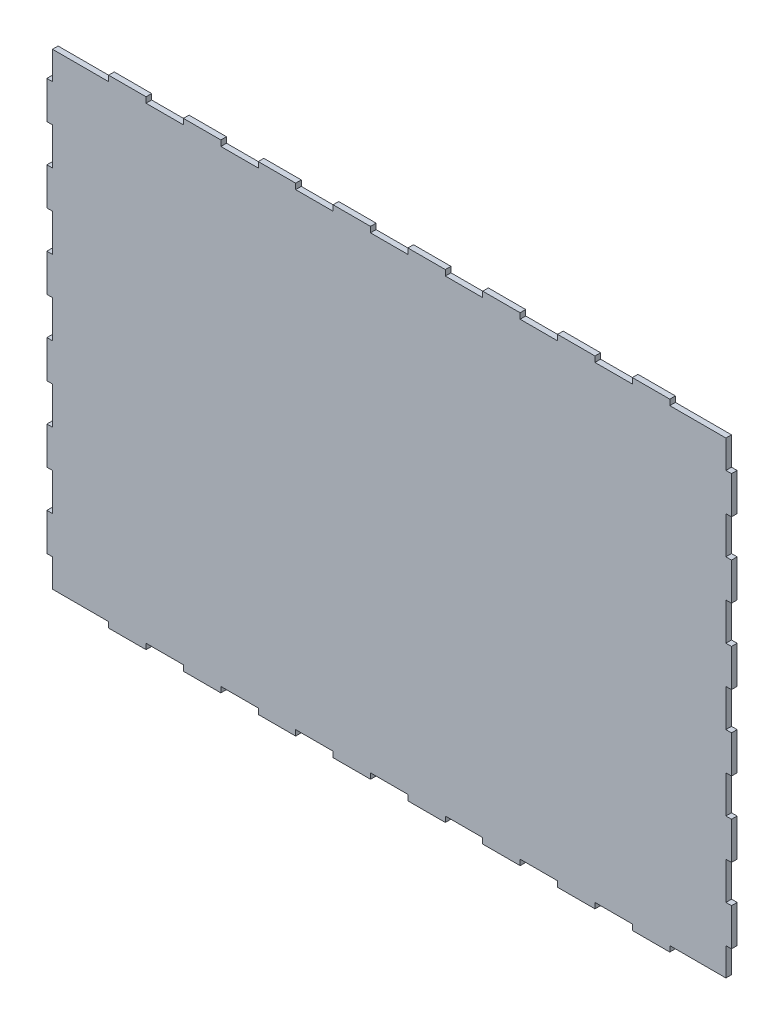
from build123d import *

# Parameters (mm, degrees)
BOSS_EXTRUDE1_DEPTH = 3


with BuildPart() as part:
    # Sketch2 → Boss-Extrude1 (new body)
    with BuildSketch(Plane.XY):
        Polygon((-2.957577841, 75.05923357), (0.042422159, 75.05923357), (0.042422159, 95.05923357), (-2.957577841, 95.05923357), (-2.957577841, 115.05923357), (0.042422159, 115.05923357), (0.042422159, 135.05923357), (-2.957577841, 135.05923357), (-2.957577841, 155.05923357), (0.042422159, 155.05923357), (0.042422159, 175.05923357), (-2.957577841, 175.05923357), (-2.957577841, 195.05923357), (0.042422159, 195.05923357), (0.042422159, 215.05923357), (-2.957577841, 215.05923357), (-2.957577841, 235.05923357), (0.042422159, 235.05923357), (0.042422159, 250.05923357), (30.042422159, 250.05923357), (30.042422159, 253.05923357), (50.042422159, 253.05923357), (50.042422159, 250.05923357), (70.042422159, 250.05923357), (70.042422159, 253.05923357), (90.042422159, 253.05923357), (90.042422159, 250.05923357), (110.042422159, 250.05923357), (110.042422159, 253.05923357), (130.042422159, 253.05923357), (130.042422159, 250.05923357), (150.042422159, 250.05923357), (150.042422159, 253.05923357), (170.042422159, 253.05923357), (170.042422159, 250.05923357), (190.042422159, 250.05923357), (190.042422159, 253.05923357), (210.042422159, 253.05923357), (210.042422159, 250.05923357), (230.042422159, 250.05923357), (230.042422159, 253.05923357), (250.042422159, 253.05923357), (250.042422159, 250.05923357), (270.042422159, 250.05923357), (270.042422159, 253.05923357), (290.042422159, 253.05923357), (290.042422159, 250.05923357), (310.042422159, 250.05923357), (310.042422159, 253.05923357), (330.042422159, 253.05923357), (330.042422159, 250.05923357), (360.042422159, 250.05923357), (360.042422159, 235.05923357), (363.042422159, 235.05923357), (363.042422159, 215.05923357), (360.042422159, 215.05923357), (360.042422159, 195.05923357), (363.042422159, 195.05923357), (363.042422159, 175.05923357), (360.042422159, 175.05923357), (360.042422159, 155.05923357), (363.042422159, 155.05923357), (363.042422159, 135.05923357), (360.042422159, 135.05923357), (360.042422159, 115.05923357), (363.042422159, 115.05923357), (363.042422159, 95.05923357), (360.042422159, 95.05923357), (360.042422159, 75.05923357), (363.042422159, 75.05923357), (363.042422159, 55.05923357), (360.042422159, 55.05923357), (360.042422159, 35.05923357), (363.042422159, 35.05923357), (363.042422159, 15.05923357), (360.042422159, 15.05923357), (360.042422159, 0.05923357), (330.042422159, 0.05923357), (330.042422159, -2.94076643), (310.042422159, -2.94076643), (310.042422159, 0.05923357), (290.042422159, 0.05923357), (290.042422159, -2.94076643), (270.042422159, -2.94076643), (270.042422159, 0.05923357), (250.042422159, 0.05923357), (250.042422159, -2.94076643), (230.042422159, -2.94076643), (230.042422159, 0.05923357), (210.042422159, 0.05923357), (210.042422159, -2.94076643), (190.042422159, -2.94076643), (190.042422159, 0.05923357), (170.042422159, 0.05923357), (170.042422159, -2.94076643), (150.042422159, -2.94076643), (150.042422159, 0.05923357), (130.042422159, 0.05923357), (130.042422159, -2.94076643), (110.042422159, -2.94076643), (110.042422159, 0.05923357), (90.042422159, 0.05923357), (90.042422159, -2.94076643), (70.042422159, -2.94076643), (70.042422159, 0.05923357), (50.042422159, 0.05923357), (50.042422159, -2.94076643), (30.042422159, -2.94076643), (30.042422159, 0.05923357), (0.042422159, 0.05923357), (0.042422159, 15.05923357), (-2.957577841, 15.05923357), (-2.957577841, 35.05923357), (0.042422159, 35.05923357), (0.042422159, 55.05923357), (-2.957577841, 55.05923357), align=None)
    extrude(amount=BOSS_EXTRUDE1_DEPTH)


solid = part.part
